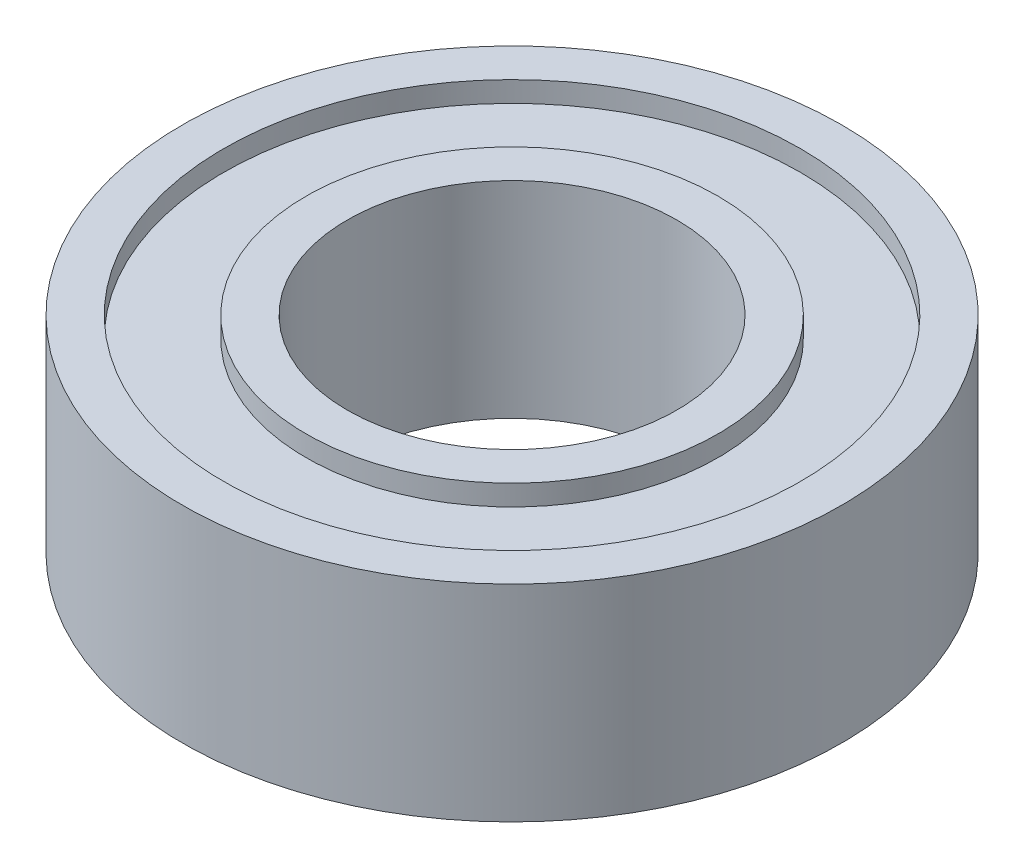
from build123d import *


with BuildPart() as part:
    # Esquisse1 → Révolution1 (revolve)
    with BuildSketch(Plane.XY, mode=Mode.PRIVATE) as r_volution1_sk:
        Polygon((7, -2.5), (7, -2), (5, -2), (5, -2.5), (4, -2.5), (4, 2.5), (5, 2.5), (5, 2), (7, 2), (7, 2.5), (8, 2.5), (8, -2.5), align=None)
    revolve(r_volution1_sk.sketch.rotate(Axis((0, -3.984065571, 0), (0, 1, 0)), 90), axis=Axis((0, -3.984065571, 0), (0, 1, 0)))


solid = part.part
